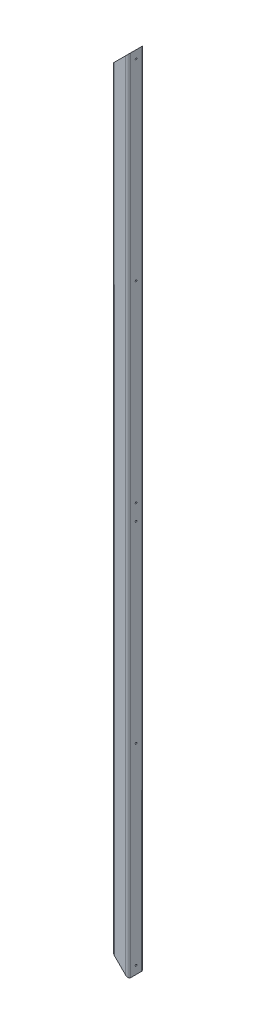
from build123d import *

# Parameters (mm, degrees)
TUBE_SQUARE_40_X_40_X_3_2_1_DEPTH = 2000
CUT_EXTRUDE1_DEPTH                = 2001.499937516
SKETCH17_R                        = 2
CUT_EXTRUDE2_DEPTH                = 3


with BuildPart() as part:
    # Sketch15 → Tube (square) 40 X 40 X 3.2(1) (new body)
    with BuildSketch(Plane(origin=(0, 0, 0), x_dir=(-1, 0, 0), z_dir=(0, 1, 0))):
        with BuildLine():
            Line((-13.6, -20), (13.6, -20))
            ThreePointArc((13.6, -20), (18.1254834, -18.1254834), (20, -13.6))
            Line((20, -13.6), (20, 13.6))
            ThreePointArc((20, 13.6), (18.1254834, 18.1254834), (13.6, 20))
            Line((13.6, 20), (-13.6, 20))
            ThreePointArc((-13.6, 20), (-18.1254834, 18.1254834), (-20, 13.6))
            Line((-20, 13.6), (-20, -13.6))
            ThreePointArc((-20, -13.6), (-18.1254834, -18.1254834), (-13.6, -20))
        make_face()
        with BuildLine():
            Line((-13.6, -16.8), (13.6, -16.8))
            ThreePointArc((13.6, -16.8), (15.8627417, -15.8627417), (16.8, -13.6))
            Line((16.8, -13.6), (16.8, 13.6))
            ThreePointArc((16.8, 13.6), (15.8627417, 15.8627417), (13.6, 16.8))
            Line((13.6, 16.8), (-13.6, 16.8))
            ThreePointArc((-13.6, 16.8), (-15.8627417, 15.8627417), (-16.8, 13.6))
            Line((-16.8, 13.6), (-16.8, -13.6))
            ThreePointArc((-16.8, -13.6), (-15.8627417, -15.8627417), (-13.6, -16.8))
        make_face(mode=Mode.SUBTRACT)
    extrude(amount=TUBE_SQUARE_40_X_40_X_3_2_1_DEPTH)

    # Sketch13 → Cut-Extrude1 (cut, through all)
    with BuildSketch(Plane(origin=(0, 0, -20), x_dir=(-1, 0, 0), z_dir=(0, 0, -1))):
        Polygon((20, 1960), (-20, 2000), (20, 2000), align=None)
        Polygon((-20, 0), (20, 40), (20, 0), align=None)
    extrude(amount=-CUT_EXTRUDE1_DEPTH, mode=Mode.SUBTRACT)

    # Sketch17 → Cut-Extrude2 (cut)
    with BuildSketch(Plane(origin=(20, 0, 0), x_dir=(0, 0, -1), z_dir=(1, 0, 0))):
        with Locations((0, 1980)):
            Circle(SKETCH17_R)
        with Locations((0, 20)):
            Circle(SKETCH17_R)
        with Locations((0, 1020)):
            Circle(SKETCH17_R)
        with Locations((0, 980)):
            Circle(SKETCH17_R)
        with Locations((0, 500)):
            Circle(SKETCH17_R)
        with Locations((0, 1500)):
            Circle(SKETCH17_R)
    extrude(amount=-CUT_EXTRUDE2_DEPTH, mode=Mode.SUBTRACT)


solid = part.part
